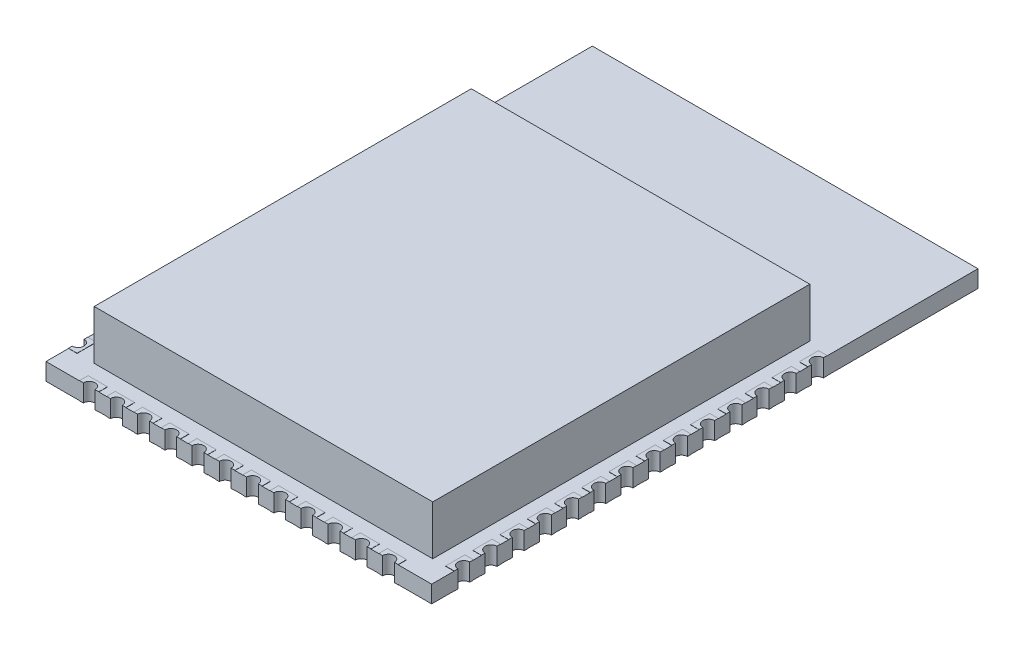
from build123d import *

# Parameters (mm, degrees)
SKETCH1_W           = 18
SKETCH1_H           = 25.5
BOSS_EXTRUDE1_DEPTH = 0.8
SKETCH2_W           = 0.4
SKETCH2_H           = 0.9
SKETCH2_W_2         = 0.9
SKETCH2_H_2         = 0.4
BOSS_EXTRUDE2_DEPTH = 0.01
SKETCH3_W           = 0.4
SKETCH3_H           = 0.9
SKETCH3_W_2         = 0.9
SKETCH3_H_2         = 0.4
BOSS_EXTRUDE3_DEPTH = 0.01
SKETCH4_W           = 15.8
SKETCH4_H           = 17.6
BOSS_EXTRUDE4_DEPTH = 2.3
SKETCH5_R           = 0.275
CUT_EXTRUDE1_DEPTH  = 28.138424788
SKETCH6_W           = 1
SKETCH6_H           = 1
BOSS_EXTRUDE5_DEPTH = 0.001


with BuildPart() as part:
    # Sketch1 → Boss-Extrude1 (new body)
    with BuildSketch(Plane(origin=(0, 0, 0), x_dir=(1, 0, 0), z_dir=(0, 1, 0))):
        with Locations((0, -12.75)):
            Rectangle(SKETCH1_W, SKETCH1_H)
    extrude(amount=BOSS_EXTRUDE1_DEPTH)

    # Sketch2 → Boss-Extrude2 (add)
    with BuildSketch(Plane(origin=(0, 0.8, 0), x_dir=(1, 0, 0), z_dir=(0, 1, 0))):
        with Locations((-8.8, -24)):
            Rectangle(SKETCH2_W, SKETCH2_H)
        with Locations((-8.8, -22.73)):
            Rectangle(SKETCH2_W, SKETCH2_H)
        with Locations((-8.8, -21.46)):
            Rectangle(SKETCH2_W, SKETCH2_H)
        with Locations((-8.8, -20.19)):
            Rectangle(SKETCH2_W, SKETCH2_H)
        with Locations((-8.8, -18.92)):
            Rectangle(SKETCH2_W, SKETCH2_H)
        with Locations((-8.8, -17.65)):
            Rectangle(SKETCH2_W, SKETCH2_H)
        with Locations((-8.8, -16.38)):
            Rectangle(SKETCH2_W, SKETCH2_H)
        with Locations((-8.8, -15.11)):
            Rectangle(SKETCH2_W, SKETCH2_H)
        with Locations((-8.8, -13.84)):
            Rectangle(SKETCH2_W, SKETCH2_H)
        with Locations((-8.8, -12.57)):
            Rectangle(SKETCH2_W, SKETCH2_H)
        with Locations((-8.8, -11.3)):
            Rectangle(SKETCH2_W, SKETCH2_H)
        with Locations((-8.8, -10.03)):
            Rectangle(SKETCH2_W, SKETCH2_H)
        with Locations((-8.8, -8.76)):
            Rectangle(SKETCH2_W, SKETCH2_H)
        with Locations((-8.8, -7.49)):
            Rectangle(SKETCH2_W, SKETCH2_H)
        with Locations((8.8, -7.49)):
            Rectangle(SKETCH2_W, SKETCH2_H)
        with Locations((8.8, -8.76)):
            Rectangle(SKETCH2_W, SKETCH2_H)
        with Locations((8.8, -10.03)):
            Rectangle(SKETCH2_W, SKETCH2_H)
        with Locations((8.8, -11.3)):
            Rectangle(SKETCH2_W, SKETCH2_H)
        with Locations((8.8, -12.57)):
            Rectangle(SKETCH2_W, SKETCH2_H)
        with Locations((8.8, -13.84)):
            Rectangle(SKETCH2_W, SKETCH2_H)
        with Locations((8.8, -15.11)):
            Rectangle(SKETCH2_W, SKETCH2_H)
        with Locations((8.8, -16.38)):
            Rectangle(SKETCH2_W, SKETCH2_H)
        with Locations((8.8, -17.65)):
            Rectangle(SKETCH2_W, SKETCH2_H)
        with Locations((8.8, -18.92)):
            Rectangle(SKETCH2_W, SKETCH2_H)
        with Locations((8.8, -20.19)):
            Rectangle(SKETCH2_W, SKETCH2_H)
        with Locations((8.8, -21.46)):
            Rectangle(SKETCH2_W, SKETCH2_H)
        with Locations((8.8, -22.73)):
            Rectangle(SKETCH2_W, SKETCH2_H)
        with Locations((8.8, -24)):
            Rectangle(SKETCH2_W, SKETCH2_H)
        with Locations((-5.715, -25.3)):
            Rectangle(SKETCH2_W_2, SKETCH2_H_2)
        with Locations((-6.985, -25.3)):
            Rectangle(SKETCH2_W_2, SKETCH2_H_2)
        with Locations((-4.445, -25.3)):
            Rectangle(SKETCH2_W_2, SKETCH2_H_2)
        with Locations((-3.175, -25.3)):
            Rectangle(SKETCH2_W_2, SKETCH2_H_2)
        with Locations((-1.905, -25.3)):
            Rectangle(SKETCH2_W_2, SKETCH2_H_2)
        with Locations((-0.635, -25.3)):
            Rectangle(SKETCH2_W_2, SKETCH2_H_2)
        with Locations((0.635, -25.3)):
            Rectangle(SKETCH2_W_2, SKETCH2_H_2)
        with Locations((1.905, -25.3)):
            Rectangle(SKETCH2_W_2, SKETCH2_H_2)
        with Locations((3.175, -25.3)):
            Rectangle(SKETCH2_W_2, SKETCH2_H_2)
        with Locations((4.445, -25.3)):
            Rectangle(SKETCH2_W_2, SKETCH2_H_2)
        with Locations((5.715, -25.3)):
            Rectangle(SKETCH2_W_2, SKETCH2_H_2)
        with Locations((6.985, -25.3)):
            Rectangle(SKETCH2_W_2, SKETCH2_H_2)
    extrude(amount=BOSS_EXTRUDE2_DEPTH)

    # Sketch3 → Boss-Extrude3 (add)
    with BuildSketch(Plane.XZ):
        with Locations((-8.8, 10.03)):
            Rectangle(SKETCH3_W, SKETCH3_H)
        with Locations((-8.8, 8.76)):
            Rectangle(SKETCH3_W, SKETCH3_H)
        with Locations((-8.8, 7.49)):
            Rectangle(SKETCH3_W, SKETCH3_H)
        with Locations((-8.8, 17.65)):
            Rectangle(SKETCH3_W, SKETCH3_H)
        with Locations((-8.8, 16.38)):
            Rectangle(SKETCH3_W, SKETCH3_H)
        with Locations((-8.8, 15.11)):
            Rectangle(SKETCH3_W, SKETCH3_H)
        with Locations((-8.8, 13.84)):
            Rectangle(SKETCH3_W, SKETCH3_H)
        with Locations((-8.8, 12.57)):
            Rectangle(SKETCH3_W, SKETCH3_H)
        with Locations((-8.8, 11.3)):
            Rectangle(SKETCH3_W, SKETCH3_H)
        with Locations((-8.8, 24)):
            Rectangle(SKETCH3_W, SKETCH3_H)
        with Locations((-8.8, 22.73)):
            Rectangle(SKETCH3_W, SKETCH3_H)
        with Locations((-8.8, 21.46)):
            Rectangle(SKETCH3_W, SKETCH3_H)
        with Locations((-8.8, 20.19)):
            Rectangle(SKETCH3_W, SKETCH3_H)
        with Locations((-8.8, 18.92)):
            Rectangle(SKETCH3_W, SKETCH3_H)
        with Locations((6.985, 25.3)):
            Rectangle(SKETCH3_W_2, SKETCH3_H_2)
        with Locations((5.715, 25.3)):
            Rectangle(SKETCH3_W_2, SKETCH3_H_2)
        with Locations((4.445, 25.3)):
            Rectangle(SKETCH3_W_2, SKETCH3_H_2)
        with Locations((3.175, 25.3)):
            Rectangle(SKETCH3_W_2, SKETCH3_H_2)
        with Locations((1.905, 25.3)):
            Rectangle(SKETCH3_W_2, SKETCH3_H_2)
        with Locations((0.635, 25.3)):
            Rectangle(SKETCH3_W_2, SKETCH3_H_2)
        with Locations((-0.635, 25.3)):
            Rectangle(SKETCH3_W_2, SKETCH3_H_2)
        with Locations((-1.905, 25.3)):
            Rectangle(SKETCH3_W_2, SKETCH3_H_2)
        with Locations((-3.175, 25.3)):
            Rectangle(SKETCH3_W_2, SKETCH3_H_2)
        with Locations((-4.445, 25.3)):
            Rectangle(SKETCH3_W_2, SKETCH3_H_2)
        with Locations((-5.715, 25.3)):
            Rectangle(SKETCH3_W_2, SKETCH3_H_2)
        with Locations((-6.985, 25.3)):
            Rectangle(SKETCH3_W_2, SKETCH3_H_2)
        with Locations((8.8, 17.65)):
            Rectangle(SKETCH3_W, SKETCH3_H)
        with Locations((8.8, 18.92)):
            Rectangle(SKETCH3_W, SKETCH3_H)
        with Locations((8.8, 20.19)):
            Rectangle(SKETCH3_W, SKETCH3_H)
        with Locations((8.8, 21.46)):
            Rectangle(SKETCH3_W, SKETCH3_H)
        with Locations((8.8, 22.73)):
            Rectangle(SKETCH3_W, SKETCH3_H)
        with Locations((8.8, 24)):
            Rectangle(SKETCH3_W, SKETCH3_H)
        with Locations((8.8, 7.49)):
            Rectangle(SKETCH3_W, SKETCH3_H)
        with Locations((8.8, 8.76)):
            Rectangle(SKETCH3_W, SKETCH3_H)
        with Locations((8.8, 10.03)):
            Rectangle(SKETCH3_W, SKETCH3_H)
        with Locations((8.8, 11.3)):
            Rectangle(SKETCH3_W, SKETCH3_H)
        with Locations((8.8, 12.57)):
            Rectangle(SKETCH3_W, SKETCH3_H)
        with Locations((8.8, 13.84)):
            Rectangle(SKETCH3_W, SKETCH3_H)
        with Locations((8.8, 15.11)):
            Rectangle(SKETCH3_W, SKETCH3_H)
        with Locations((8.8, 16.38)):
            Rectangle(SKETCH3_W, SKETCH3_H)
    extrude(amount=BOSS_EXTRUDE3_DEPTH)

    # Sketch4 → Boss-Extrude4 (add)
    with BuildSketch(Plane(origin=(0, 0.8, 0), x_dir=(1, 0, 0), z_dir=(0, 1, 0))):
        with Locations((0.1, -15.65)):
            Rectangle(SKETCH4_W, SKETCH4_H)
    extrude(amount=BOSS_EXTRUDE4_DEPTH)

    # Sketch5 → Cut-Extrude1 (cut, through all)
    with BuildSketch(Plane(origin=(0, 0.81, 0), x_dir=(1, 0, 0), z_dir=(0, 1, 0))):
        with Locations((-9, -7.49)):
            Circle(SKETCH5_R)
        with Locations((-9, -8.76)):
            Circle(SKETCH5_R)
        with Locations((-9, -10.03)):
            Circle(SKETCH5_R)
        with Locations((-9, -11.3)):
            Circle(SKETCH5_R)
        with Locations((-9, -12.57)):
            Circle(SKETCH5_R)
        with Locations((-9, -13.84)):
            Circle(SKETCH5_R)
        with Locations((-9, -15.11)):
            Circle(SKETCH5_R)
        with Locations((-9, -16.38)):
            Circle(SKETCH5_R)
        with Locations((-9, -17.65)):
            Circle(SKETCH5_R)
        with Locations((-9, -18.92)):
            Circle(SKETCH5_R)
        with Locations((-9, -20.19)):
            Circle(SKETCH5_R)
        with Locations((-9, -21.46)):
            Circle(SKETCH5_R)
        with Locations((-9, -22.73)):
            Circle(SKETCH5_R)
        with Locations((-9, -24)):
            Circle(SKETCH5_R)
        with Locations((9, -24)):
            Circle(SKETCH5_R)
        with Locations((9, -22.73)):
            Circle(SKETCH5_R)
        with Locations((9, -21.46)):
            Circle(SKETCH5_R)
        with Locations((9, -20.19)):
            Circle(SKETCH5_R)
        with Locations((9, -18.92)):
            Circle(SKETCH5_R)
        with Locations((9, -17.65)):
            Circle(SKETCH5_R)
        with Locations((9, -16.38)):
            Circle(SKETCH5_R)
        with Locations((9, -15.11)):
            Circle(SKETCH5_R)
        with Locations((9, -13.84)):
            Circle(SKETCH5_R)
        with Locations((9, -12.57)):
            Circle(SKETCH5_R)
        with Locations((9, -11.3)):
            Circle(SKETCH5_R)
        with Locations((9, -10.03)):
            Circle(SKETCH5_R)
        with Locations((9, -8.76)):
            Circle(SKETCH5_R)
        with Locations((9, -7.49)):
            Circle(SKETCH5_R)
        with Locations((-6.985, -25.5)):
            Circle(SKETCH5_R)
        with Locations((-5.715, -25.5)):
            Circle(SKETCH5_R)
        with Locations((-4.445, -25.5)):
            Circle(SKETCH5_R)
        with Locations((-3.175, -25.5)):
            Circle(SKETCH5_R)
        with Locations((-1.905, -25.5)):
            Circle(SKETCH5_R)
        with Locations((-0.635, -25.5)):
            Circle(SKETCH5_R)
        with Locations((0.635, -25.5)):
            Circle(SKETCH5_R)
        with Locations((1.905, -25.5)):
            Circle(SKETCH5_R)
        with Locations((3.175, -25.5)):
            Circle(SKETCH5_R)
        with Locations((4.445, -25.5)):
            Circle(SKETCH5_R)
        with Locations((5.715, -25.5)):
            Circle(SKETCH5_R)
        with Locations((6.985, -25.5)):
            Circle(SKETCH5_R)
    extrude(amount=-CUT_EXTRUDE1_DEPTH, mode=Mode.SUBTRACT)

    # Sketch6 → Boss-Extrude5 (add)
    with BuildSketch(Plane(origin=(0, 0, 0), x_dir=(-1, 0, 0), z_dir=(0, -1, 0))):
        with Locations((1.36, -11.34)):
            Rectangle(SKETCH6_W, SKETCH6_H)
        with Locations((1.36, -12.84)):
            Rectangle(SKETCH6_W, SKETCH6_H)
        with Locations((1.36, -14.34)):
            Rectangle(SKETCH6_W, SKETCH6_H)
        with Locations((2.86, -14.34)):
            Rectangle(SKETCH6_W, SKETCH6_H)
        with Locations((2.86, -12.84)):
            Rectangle(SKETCH6_W, SKETCH6_H)
        with Locations((2.86, -11.34)):
            Rectangle(SKETCH6_W, SKETCH6_H)
        with Locations((-0.14, -11.34)):
            Rectangle(SKETCH6_W, SKETCH6_H)
        with Locations((-0.14, -12.84)):
            Rectangle(SKETCH6_W, SKETCH6_H)
        with Locations((-0.14, -14.34)):
            Rectangle(SKETCH6_W, SKETCH6_H)
    extrude(amount=BOSS_EXTRUDE5_DEPTH)


solid = part.part
